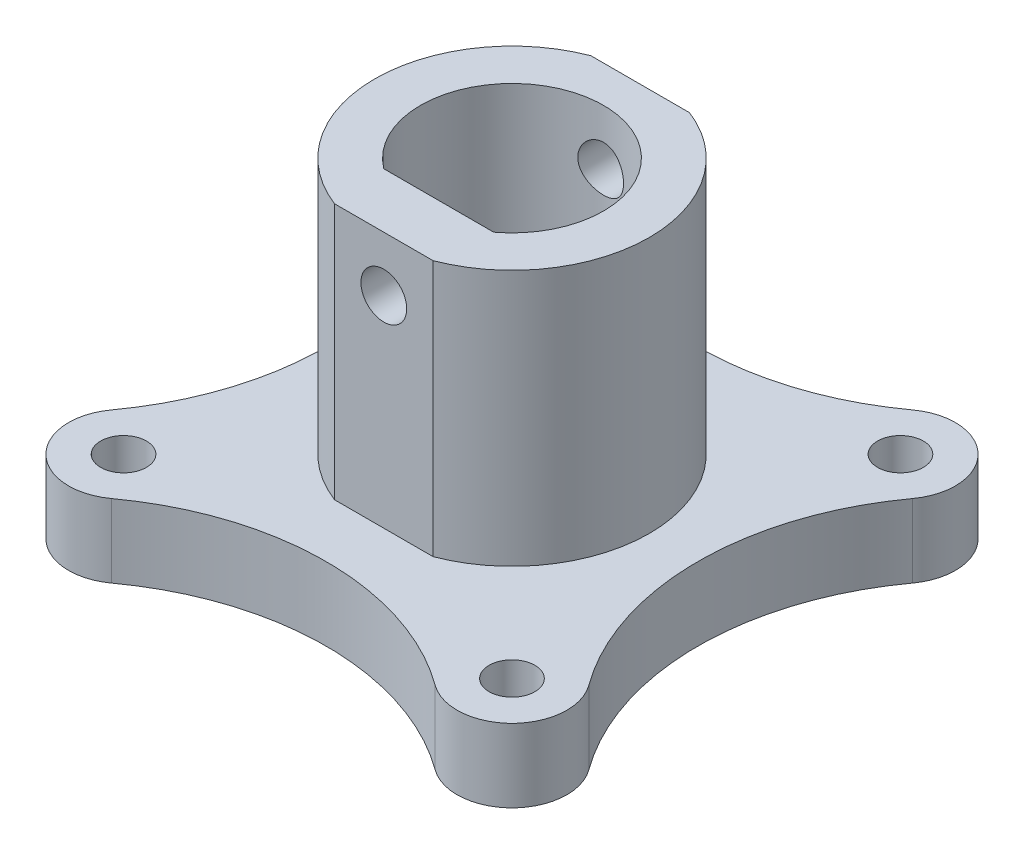
from build123d import *

# Parameters (mm, degrees)
EXTRUDE_1_DEPTH    = 4
EXTRUDE_2_DEPTH    = 14
HOLE_WIZARD_M3_1_D = 2.5
HOLE_WIZARD_M3_2_D = 2.5


with BuildPart() as part:
    # 草图1 → 凸台-拉伸1 (new body)
    with BuildSketch(Plane(origin=(0, 0, 0), x_dir=(1, 0, 0), z_dir=(0, 1, 0))):
        with BuildLine():
            ThreePointArc((-8.838834765, 13.030441647), (-12.727922061, 12.727922061), (-13.030441647, 8.838834765))
            ThreePointArc((-13.030441647, 8.838834765), (-10.14964129, 0), (-13.030441647, -8.838834765))
            ThreePointArc((-13.030441647, -8.838834765), (-12.727922061, -12.727922061), (-8.838834765, -13.030441647))
            ThreePointArc((-8.838834765, -13.030441647), (0, -10.14964129), (8.838834765, -13.030441647))
            ThreePointArc((8.838834765, -13.030441647), (12.727922061, -12.727922061), (13.030441647, -8.838834765))
            ThreePointArc((13.030441647, -8.838834765), (10.14964129, 0), (13.030441647, 8.838834765))
            ThreePointArc((13.030441647, 8.838834765), (12.727922061, 12.727922061), (8.838834765, 13.030441647))
            ThreePointArc((8.838834765, 13.030441647), (0, 10.14964129), (-8.838834765, 13.030441647))
        make_face()
        with BuildLine():
            Line((-3, -4), (3, -4))
            ThreePointArc((3, -4), (0, 5), (-3, -4))
        make_face(mode=Mode.SUBTRACT)
    extrude(amount=EXTRUDE_1_DEPTH)

    # 草图2 → 凸台-拉伸2 (add)
    with BuildSketch(Plane(origin=(0, 4, 0), x_dir=(1, 0, 0), z_dir=(0, 1, 0))):
        with BuildLine():
            Line((-2.692582404, 7), (2.692582404, 7))
            ThreePointArc((2.692582404, 7), (7.5, 0), (2.692582404, -7))
            Line((2.692582404, -7), (-2.692582404, -7))
            ThreePointArc((-2.692582404, -7), (-7.5, 0), (-2.692582404, 7))
        make_face()
        with BuildLine():
            Line((-3, -4), (3, -4))
            ThreePointArc((3, -4), (0, 5), (-3, -4))
        make_face(mode=Mode.SUBTRACT)
    extrude(amount=EXTRUDE_2_DEPTH)

    # M3 螺纹孔1 (through all)
    with Locations(Plane(origin=(0, 4, 0), x_dir=(1, 0, 0), z_dir=(0, 1, 0))):
        with Locations((-10.606601718, 10.606601718), (10.606601718, 10.606601718), (10.606601718, -10.606601718), (-10.606601718, -10.606601718)):
            Hole(HOLE_WIZARD_M3_1_D / 2)

    # M3 螺纹孔2 (through all)
    with Locations(Plane.XY.offset(7)):
        with Locations((0, 15)):
            Hole(HOLE_WIZARD_M3_2_D / 2)


solid = part.part
